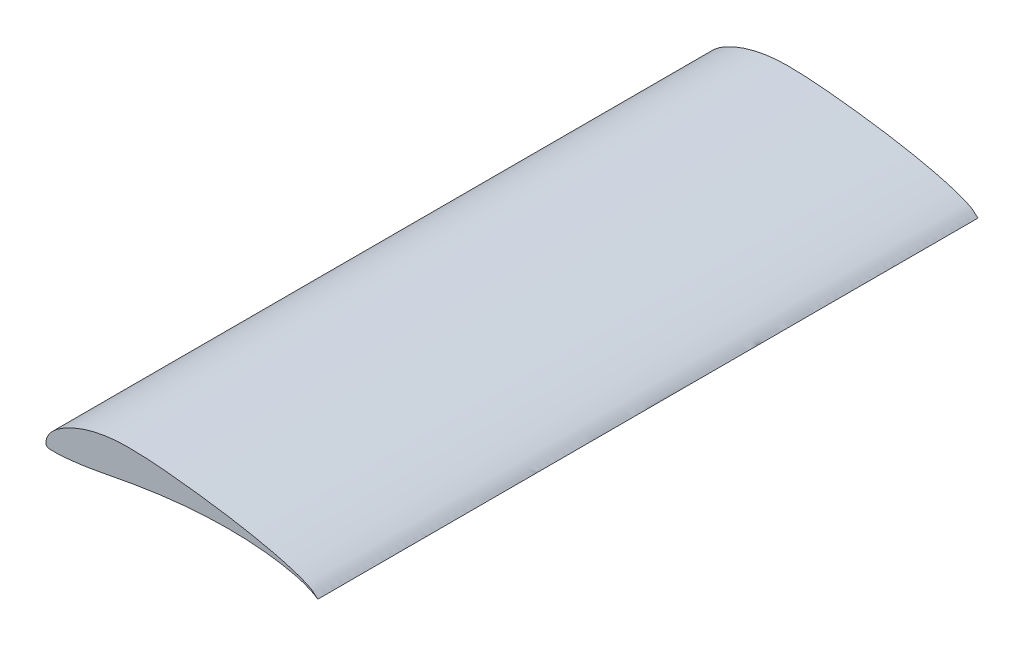
from build123d import *

# Parameters (mm, degrees)
BOSS_EXTRUDE1_DEPTH = 431.8


with BuildPart() as part:
    # Sketch1 → Boss-Extrude1 (new body)
    with BuildSketch(Plane.XY):
        with BuildLine():
            add(Edge.make_bspline(
                [(177.8, 0), (177.801065159, 0.004526026), (177.216655269, 0.440103726), (176.722426294, 0.925190769), (175.625027607, 1.938401513), (174.330334023, 3.016285357), (172.559239339, 4.102990381), (170.356819615, 5.156211959), (167.697951774, 6.255436719), (164.586686425, 7.385364505), (161.037538095, 8.538014471), (157.068930977, 9.703380945), (152.703088341, 10.875993654), (147.964115764, 12.045088456), (142.879182717, 13.202203526), (137.4785966, 14.340111776), (131.79533608, 15.452962612), (125.862616058, 16.527067909), (119.717796863, 17.560888233), (113.396290347, 18.541118494), (106.938979238, 19.469663852), (100.387246956, 20.33916769), (93.78854832, 21.146843199), (87.195636958, 21.898392468), (80.663090222, 22.574870722), (74.244126574, 23.163628491), (67.983886899, 23.631580321), (61.918128247, 23.953766374), (56.080590549, 24.093441326), (50.501183669, 24.079614352), (45.190297742, 23.807321577), (40.145871803, 23.25457306), (35.347380095, 22.47258674), (30.793664176, 21.45925136), (26.489411585, 20.270800495), (22.452836837, 18.928293164), (18.701111426, 17.463136908), (15.2575488, 15.883180958), (12.133196836, 14.220512842), (9.345054691, 12.494043418), (6.910609202, 10.72717125), (4.830870982, 8.95735582), (3.13599234, 7.165269395), (1.834038496, 5.366432591), (0.872247283, 3.616352788), (0.255750277, 1.954685148), (-0.038135083, 0.420920249), (0.018325382, -0.876332495), (0.352106061, -2.066169616), (1.593465313, -2.65699398), (3.262608475, -2.740135641), (5.545995642, -2.820828564), (8.417553882, -2.697483693), (11.844812301, -2.470503009), (15.789635087, -2.106669931), (20.211655012, -1.614234511), (25.089311324, -0.982610431), (30.420239269, -0.099572386), (36.230389426, 1.007889794), (42.54878646, 2.213162869), (49.344542431, 3.48573756), (56.574965315, 4.772753185), (64.186948103, 6.025872935), (72.121431108, 7.20321912), (80.310029769, 8.26156508), (88.679102734, 9.170066682), (97.149587851, 9.887888502), (105.636479783, 10.396319112), (114.051109804, 10.675202499), (122.302191882, 10.709221254), (130.297671937, 10.495985334), (137.94599741, 10.040470589), (145.155198337, 9.348553257), (151.839447935, 8.446760474), (157.91172183, 7.361240926), (163.300829263, 6.128327828), (167.90745792, 4.809250531), (171.677453338, 3.401609766), (174.367200413, 2.11356583), (176.350238645, 0.922681715), (177.112036096, 0.461830148), (177.798913186, -0.00461804), (177.8, 0)],
                knots=[0, 0, 0, 0, 0.000979678, 0.003648862, 0.007483499, 0.012095277, 0.017525591, 0.02405178, 0.031783051, 0.040677828, 0.050710301, 0.061833229, 0.07398925, 0.087118173, 0.101145049, 0.115990637, 0.131570422, 0.147788379, 0.164550917, 0.181757895, 0.199311955, 0.217095072, 0.234990228, 0.252856883, 0.270540594, 0.287886779, 0.304773438, 0.321101419, 0.336806063, 0.351800033, 0.366031063, 0.379615675, 0.392652963, 0.405170359, 0.417171919, 0.428603517, 0.439418959, 0.449596586, 0.459102079, 0.467907878, 0.475988301, 0.483308969, 0.489874508, 0.49580325, 0.501149412, 0.505903073, 0.510046769, 0.513579311, 0.516446927, 0.519350053, 0.523823355, 0.529973794, 0.537715654, 0.546967844, 0.557637367, 0.569620481, 0.582804124, 0.597246961, 0.613135037, 0.6304436, 0.649056124, 0.668822257, 0.689594964, 0.711189651, 0.733426689, 0.756094118, 0.778988554, 0.801889683, 0.824566598, 0.846792285, 0.868338291, 0.888978163, 0.908492011, 0.926658768, 0.943286193, 0.95816921, 0.971135822, 0.981955623, 0.990251791, 0.995852565, 0.999000406, 1, 1, 1, 1], degree=3))
        make_face()
    extrude(amount=BOSS_EXTRUDE1_DEPTH)


solid = part.part
